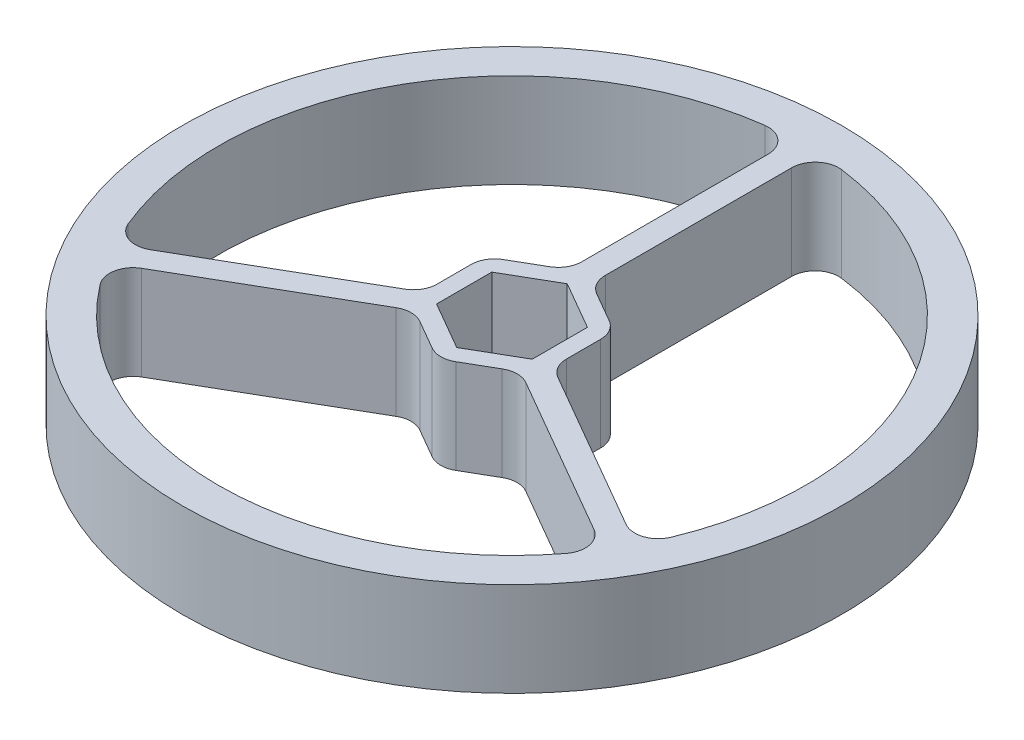
from build123d import *

# Parameters (mm, degrees)
SKETCH1_R           = 44.45
BOSS_EXTRUDE1_DEPTH = 12.7
FILLET1_R           = 3.175


with BuildPart() as part:
    # Sketch1 → Boss-Extrude1 (new body)
    with BuildSketch(Plane(origin=(0, 0, 0), x_dir=(1, 0, 0), z_dir=(0, 1, 0))):
        with Locations(Location((0, 0, 0), (0, 0, 270))):
            Circle(SKETCH1_R)
        Polygon((-6.4516, 3.724832997), (0, 7.449665993), (6.4516, 3.724832997), (6.4516, -3.724832997), (0, -7.449665993), (-6.4516, -3.724832997), align=None, mode=Mode.SUBTRACT)
        with BuildLine():
            Line((1.5875, 9.172767872), (1.5875, 39.592186347))
            ThreePointArc((1.5875, 39.592186347), (34.3153906, 19.812), (35.081589168, -18.421277845))
            Line((35.081589168, -18.421277845), (8.7376, -3.211568607))
            Line((8.7376, -3.211568607), (8.7376, 5.044655712))
            Line((8.7376, 5.044655712), (1.5875, 9.172767872))
        make_face(mode=Mode.SUBTRACT)
        with BuildLine():
            Line((-1.5875, 39.592186347), (-1.5875, 9.172767872))
            Line((-1.5875, 9.172767872), (-8.7376, 5.044655712))
            Line((-8.7376, 5.044655712), (-8.7376, -3.211568607))
            Line((-8.7376, -3.211568607), (-35.081589168, -18.421277845))
            ThreePointArc((-35.081589168, -18.421277845), (-34.3153906, 19.812), (-1.5875, 39.592186347))
        make_face(mode=Mode.SUBTRACT)
        with BuildLine():
            Line((-33.494089168, -21.170908502), (-7.1501, -5.961199264))
            Line((-7.1501, -5.961199264), (0, -10.089311424))
            Line((0, -10.089311424), (7.1501, -5.961199264))
            Line((7.1501, -5.961199264), (33.494089168, -21.170908502))
            ThreePointArc((33.494089168, -21.170908502), (0, -39.624), (-33.494089168, -21.170908502))
        make_face(mode=Mode.SUBTRACT)
    extrude(amount=BOSS_EXTRUDE1_DEPTH)

    # Fillet1
    fillet1_edges = [part.edges().sort_by_distance(p)[0] for p in [
        (-8.7376, 6.35, -5.044655712),
        (-1.5875, 6.35, -9.172767872),
        (-1.5875, 6.35, -39.592186347),
        (-35.081589168, 6.35, 18.421277845),
        (-8.7376, 6.35, 3.211568607),
        (35.081589168, 6.35, 18.421277845),
        (1.5875, 6.35, -39.592186347),
        (1.5875, 6.35, -9.172767872),
        (8.7376, 6.35, -5.044655712),
        (8.7376, 6.35, 3.211568607),
        (-33.494089168, 6.35, 21.170908502),
        (33.494089168, 6.35, 21.170908502),
        (7.1501, 6.35, 5.961199264),
        (0, 6.35, 10.089311424),
        (-7.1501, 6.35, 5.961199264),
    ]]
    fillet(fillet1_edges, radius=FILLET1_R)


solid = part.part
